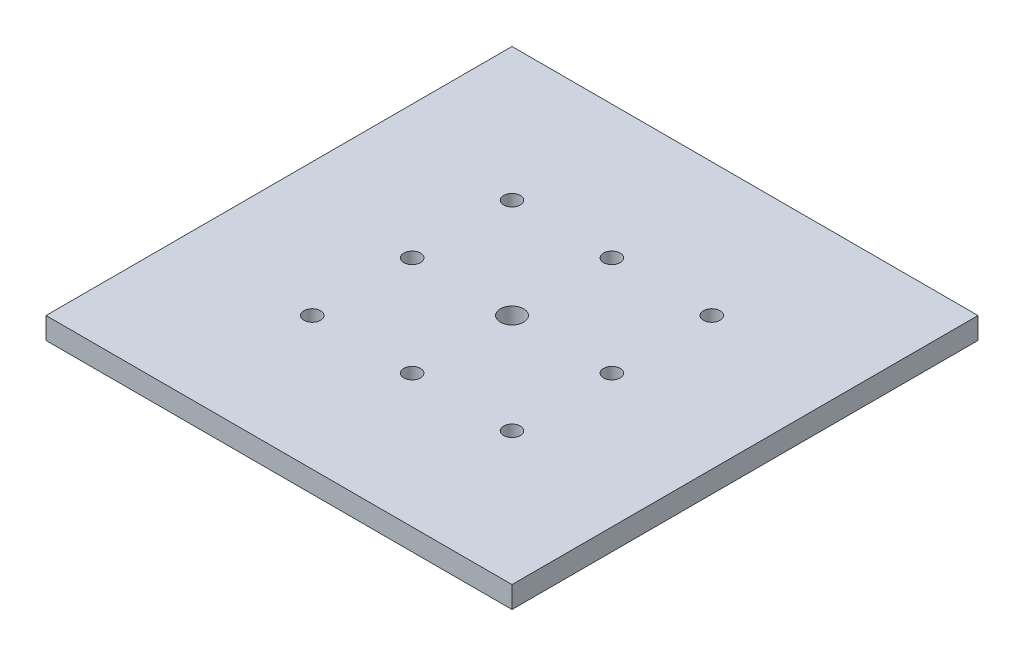
from build123d import *

# Parameters (mm, degrees)
CROQUIS1_W              = 110
CROQUIS1_H              = 110
CROQUIS1_W_2            = 75
CROQUIS1_H_2            = 75
SALIENTE_EXTRUIR1_DEPTH = 6.5
CROQUIS2_W              = 140
CROQUIS2_H              = 140
CROQUIS2_R              = 3.5
CROQUIS2_R_2            = 2.5
SALIENTE_EXTRUIR2_DEPTH = 6.5


with BuildPart() as part:
    # Croquis1 → Saliente-Extruir1 (new body)
    with BuildSketch(Plane(origin=(0, 0, 0), x_dir=(1, 0, 0), z_dir=(0, 1, 0))):
        with Locations((55, 55)):
            Rectangle(CROQUIS1_W, CROQUIS1_H)
        with Locations((55, 55)):
            Rectangle(CROQUIS1_W_2, CROQUIS1_H_2, mode=Mode.SUBTRACT)
    extrude(amount=SALIENTE_EXTRUIR1_DEPTH)

    # Croquis2 → Saliente-Extruir2 (add)
    with BuildSketch(Plane(origin=(0, 6.5, 0), x_dir=(1, 0, 0), z_dir=(0, 1, 0))):
        with Locations((55, 55)):
            Rectangle(CROQUIS2_W, CROQUIS2_H)
        with Locations(Location((55, 55, 0), (0, 0, 90))):
            Circle(CROQUIS2_R, mode=Mode.SUBTRACT)
        with Locations(Location((25, 85, 0), (0, 0, 90))):
            Circle(CROQUIS2_R_2, mode=Mode.SUBTRACT)
        with Locations(Location((85, 85, 0), (0, 0, 90))):
            Circle(CROQUIS2_R_2, mode=Mode.SUBTRACT)
        with Locations(Location((85, 25, 0), (0, 0, 90))):
            Circle(CROQUIS2_R_2, mode=Mode.SUBTRACT)
        with Locations(Location((25, 25, 0), (0, 0, 90))):
            Circle(CROQUIS2_R_2, mode=Mode.SUBTRACT)
        with Locations(Location((55, 85, 0), (0, 0, 90))):
            Circle(CROQUIS2_R_2, mode=Mode.SUBTRACT)
        with Locations(Location((85, 55, 0), (0, 0, 90))):
            Circle(CROQUIS2_R_2, mode=Mode.SUBTRACT)
        with Locations(Location((55, 25, 0), (0, 0, 90))):
            Circle(CROQUIS2_R_2, mode=Mode.SUBTRACT)
        with Locations(Location((25, 55, 0), (0, 0, 90))):
            Circle(CROQUIS2_R_2, mode=Mode.SUBTRACT)
    extrude(amount=SALIENTE_EXTRUIR2_DEPTH)


solid = part.part
